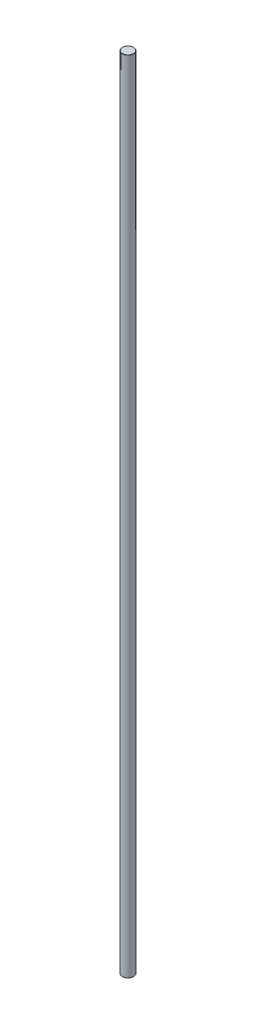
from build123d import *

# Parameters (mm, degrees)
SKIZZE1_R                       = 7
AUFSATZ_LINEAR_AUSTRAGEN1_DEPTH = 1000
FASE1_SIZE                      = 0.2


with BuildPart() as part:
    # Skizze1 → Aufsatz-Linear austragen1 (new body)
    with BuildSketch(Plane(origin=(0, 0, 0), x_dir=(1, 0, 0), z_dir=(0, 1, 0))):
        Circle(SKIZZE1_R)
    extrude(amount=-AUFSATZ_LINEAR_AUSTRAGEN1_DEPTH)

    # Fase1
    fase1_edges = [part.edges().sort_by_distance(p)[0] for p in [
        (-7, 0, 0),
        (-7, -1000, 0),
    ]]
    chamfer(fase1_edges, length=FASE1_SIZE)


solid = part.part
